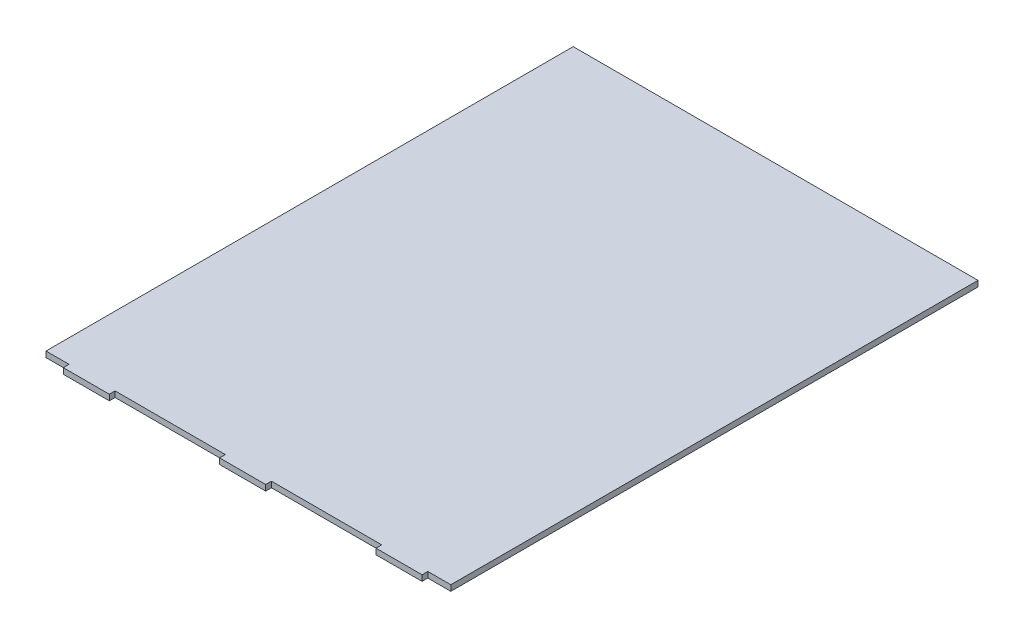
from build123d import *

# Parameters (mm, degrees)
BOSS_EXTRUDE1_DEPTH = 3.175


with BuildPart() as part:
    # Sketch1 → Boss-Extrude1 (new body)
    with BuildSketch(Plane(origin=(0, 0, 0), x_dir=(1, 0, 0), z_dir=(0, 1, 0))):
        Polygon((0, 0), (12.7, 0), (12.7, -3.175), (38.1, -3.175), (38.1, 0), (96.722428365, 0), (98.95586, 0), (98.95586, -3.175), (124.35586, -3.175), (124.35586, 0), (180.744856729, 0), (185.21172, 0), (185.21172, -3.175), (210.61172, -3.175), (210.61172, 0), (223.31172, 0), (223.31172, 290.83), (0, 290.83), align=None)
    extrude(amount=BOSS_EXTRUDE1_DEPTH)


solid = part.part
